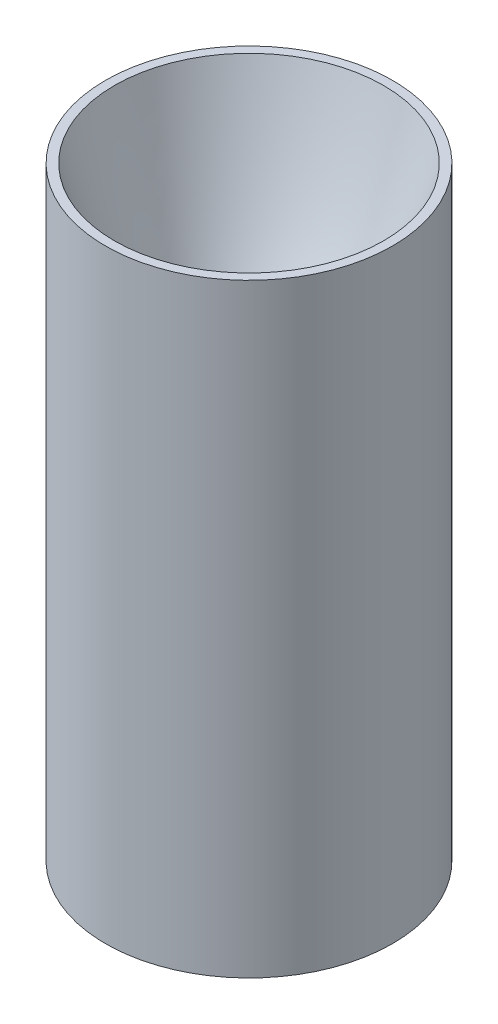
from build123d import *

# Parameters (mm, degrees)
CIRPATTERN1_COUNT  = 8
SKETCH9_R          = 56.881527661
SKETCH9_R_2        = 53.881527661
CUT_EXTRUDE1_DEPTH = 6


with BuildPart() as part:
    # Sketch1 → Revolve2 (revolve)
    with BuildSketch(Plane.XY, mode=Mode.PRIVATE) as revolve2_sk:
        with BuildLine():
            Line((71.727523602, 109.927507641), (76.490023602, 109.927507641))
            Line((76.490023602, 109.927507641), (76.490023602, -212.127513222))
            Line((76.490023602, -212.127513222), (53.881527661, -212.127513222))
            Line((53.881527661, -212.127513222), (53.881527661, -59.727513222))
            add(Edge.make_bspline(
                [(53.881527661, -59.727513222), (53.88152643, -59.656983157), (53.880997287, -59.515406103), (53.878621437, -59.181564616), (53.872296838, -58.904795493), (53.862811351, -58.532567488), (53.850168453, -58.212837622), (53.830417626, -57.781594443), (53.800405285, -57.280959899), (53.756193121, -56.687998165), (53.677288452, -55.848480366), (53.577426861, -55.00816586), (53.456675786, -54.17243543), (53.286810822, -53.17242524), (53.092064187, -52.177442821), (52.86637512, -51.188539083), (52.610014224, -50.207489038), (52.32928934, -49.23307774), (52.024348739, -48.265969224), (51.633537831, -47.149135067), (51.139520361, -45.890408405), (50.598733753, -44.650968804), (50.012060928, -43.432701526), (49.380120231, -42.237093239), (48.704125229, -41.066154879), (47.98447552, -39.920972657), (47.223102138, -38.804076239), (46.51986906, -37.851451785), (45.893537937, -37.055672123), (45.352817681, -36.403381282), (44.915126948, -35.894247633), (44.51477619, -35.446992657), (44.181457503, -35.084631185), (43.873924624, -34.760340151), (43.674072407, -34.551549451), (43.444392073, -34.318516288), (43.343783151, -34.217162055), (43.293911001, -34.167289665)],
                knots=[0.082637729, 0.082637729, 0.082637729, 0.082637729, 0.082637729, 0.092574926, 0.102512123, 0.11244932, 0.122386517, 0.132323714, 0.142260911, 0.162135305, 0.182009699, 0.201884093, 0.24163288, 0.261507274, 0.281381668, 0.321130456, 0.360879243, 0.380753637, 0.400628031, 0.440376819, 0.480125606, 0.519874394, 0.559623181, 0.599371969, 0.639120757, 0.678869544, 0.718618332, 0.75836712, 0.798115907, 0.817990301, 0.837864695, 0.857739089, 0.877613483, 0.88755068, 0.897487877, 0.907425074, 0.91736227, 0.91736227, 0.91736227, 0.91736227, 0.91736227], degree=4))
            Line((43.293911001, -34.167289665), (34.686282803, -25.559661468))
            add(Edge.make_bspline(
                [(24.099067874, 0.000160672), (24.099069105, -0.070367974), (24.099598252, -0.213423516), (24.101973937, -0.543022243), (24.108298331, -0.823999723), (24.117783452, -1.194661398), (24.130425744, -1.513274385), (24.146225968, -1.86177893), (24.165181227, -2.193546198), (24.19281884, -2.617908727), (24.232287047, -3.121873274), (24.303299707, -3.879818002), (24.423126678, -4.886289715), (24.599486044, -6.056550088), (24.850885233, -7.385005743), (25.151795313, -8.703413843), (25.501770623, -10.009476538), (25.900360983, -11.301658927), (26.346945392, -12.577938667), (26.841003323, -13.836726817), (27.381673122, -15.076036463), (27.968479386, -16.294449129), (28.600139398, -17.489778131), (29.276532396, -18.661127095), (29.995445102, -19.805582737), (30.758021999, -20.923699417), (31.459167193, -21.874251104), (32.088736123, -22.673284825), (32.624128416, -23.320261484), (33.072255768, -23.839844364), (33.508450026, -24.329655594), (33.935826121, -24.788323739), (34.24555864, -25.11370766), (34.536859958, -25.409488397), (34.636412425, -25.509789283), (34.686282803, -25.559661468)],
                knots=[0.082637729, 0.082637729, 0.082637729, 0.082637729, 0.082637729, 0.092574926, 0.102512123, 0.11244932, 0.122386517, 0.132323714, 0.142260911, 0.152198108, 0.162135305, 0.182009699, 0.201884093, 0.24163288, 0.281381668, 0.321130456, 0.360879243, 0.400628031, 0.440376819, 0.480125606, 0.519874394, 0.559623181, 0.599371969, 0.639120757, 0.678869544, 0.718618332, 0.75836712, 0.798115907, 0.817990301, 0.837864695, 0.857739089, 0.877613483, 0.897487877, 0.907425074, 0.91736227, 0.91736227, 0.91736227, 0.91736227, 0.91736227], degree=4))
            add(Edge.make_bspline(
                [(24.099067874, 0.000160672), (24.0990685, 0.036053324), (24.099606331, 0.110274362), (24.102023723, 0.267801742), (24.108461568, 0.427224789), (24.120533599, 0.646924939), (24.141435087, 0.901594), (24.175184719, 1.202697945), (24.226499305, 1.54221117), (24.290543701, 1.881157449), (24.367141601, 2.216515092), (24.456323571, 2.549400093), (24.557741413, 2.878253317), (24.671619071, 3.203507713), (24.797196771, 3.523787829), (24.935285977, 3.839827405), (25.084070301, 4.149442857), (25.246012222, 4.454943795), (25.416488505, 4.751462248), (25.602514721, 5.045864533), (25.79178827, 5.325679608), (26.004405474, 5.610888215), (26.178876374, 5.83307432), (26.366345756, 6.050112309), (26.504555248, 6.208802318), (26.67044207, 6.382282451), (26.744520261, 6.458639514), (26.795279203, 6.509400323)],
                knots=[0.082568816, 0.082568816, 0.082568816, 0.082568816, 0.082568816, 0.102426634, 0.122284453, 0.142142271, 0.162000089, 0.201715725, 0.241431362, 0.281146998, 0.320862634, 0.360578271, 0.400293907, 0.440009544, 0.47972518, 0.519440816, 0.559156453, 0.598872089, 0.638587725, 0.678303362, 0.718018998, 0.757734635, 0.797450271, 0.837165907, 0.857023726, 0.876881544, 0.91659718, 0.91659718, 0.91659718, 0.91659718, 0.91659718], degree=4))
            add(Edge.make_bspline(
                [(26.795279203, 6.509400323), (49.261401403, 34.636114842), (71.727523602, 109.927507641)],
                knots=[0, 0, 0, 1, 1, 1], degree=2))
        make_face()
    revolve(revolve2_sk.sketch.rotate(Axis((-0.005532126, 165.815985114, 0), (0, -1, 0)), 180), axis=Axis((-0.005532126, 165.815985114, 0), (0, -1, 0)))

    # Sketch4 → 3/8-24 Tapped Hole1 (revolve, cut)
    with BuildSketch(Plane(origin=(65.2, -212.127513222, 0), x_dir=(0, 0, -1), z_dir=(1, 0, 0))):
        Polygon((0, 0), (0, 27.533468714), (4.2164, 25), (4.2164, 0), align=None)
    f_3_8_24_tapped_hole1 = revolve(axis=Axis((65.2, -218.477513222, 0), (0, 1, 0)), mode=Mode.SUBTRACT)

    # CirPattern1: 3/8-24 Tapped Hole1 ×8 about axis
    cirpattern1_axis = Axis((0, -228.487022387, 0), (-1.634718801334702e-05, 0.9999999998663848, 0))
    for i in range(1, CIRPATTERN1_COUNT):
        add(f_3_8_24_tapped_hole1.rotate(cirpattern1_axis, i * 360 / CIRPATTERN1_COUNT), mode=Mode.SUBTRACT)

    # Sketch9 → Cut-Extrude1 (cut)
    with BuildSketch(Plane.XZ.offset(212.127513222)):
        Circle(SKETCH9_R)
        Circle(SKETCH9_R_2, mode=Mode.SUBTRACT)
    extrude(amount=-CUT_EXTRUDE1_DEPTH, mode=Mode.SUBTRACT)


with BuildPart() as cut_extrude1_kept_piece:
    # of the separate pieces the step leaves, the one the design keeps (cut_extrude1_pieces_kept)
    add(part.part.solids().sort_by_distance((-71.738587854, 109.927507641, 0))[0])


solid = cut_extrude1_kept_piece.part
